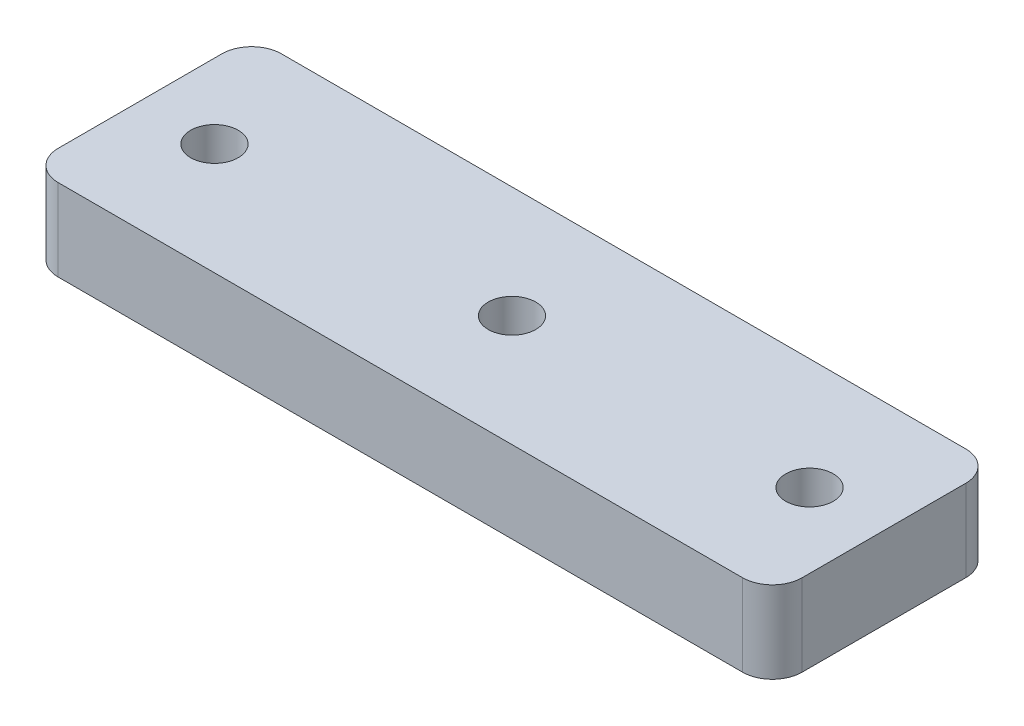
from build123d import *

# Parameters (mm, degrees)
SKETCH_1_W      = 50
SKETCH_1_H      = 15
SKETCH_1_R      = 1.6
EXTRUDE_1_DEPTH = 5.5
FILLET_1_R      = 2


with BuildPart() as part:
    # 草图1 → 凸台-拉伸1 (new body)
    with BuildSketch(Plane(origin=(0, 0, 0), x_dir=(1, 0, 0), z_dir=(0, 1, 0))):
        Rectangle(SKETCH_1_W, SKETCH_1_H)
        with Locations(Location((-20, 0, 0), (0, 0, 270))):
            Circle(SKETCH_1_R, mode=Mode.SUBTRACT)
        with Locations(Location((0, 0, 0), (0, 0, 270))):
            Circle(SKETCH_1_R, mode=Mode.SUBTRACT)
        with Locations(Location((20, 0, 0), (0, 0, 270))):
            Circle(SKETCH_1_R, mode=Mode.SUBTRACT)
    extrude(amount=EXTRUDE_1_DEPTH)

    # 圆角1
    fillet_1_edges = [part.edges().sort_by_distance(p)[0] for p in [
        (25, 2.75, 7.5),
        (-25, 2.75, 7.5),
        (-25, 2.75, -7.5),
        (25, 2.75, -7.5),
    ]]
    fillet(fillet_1_edges, radius=FILLET_1_R)


solid = part.part
